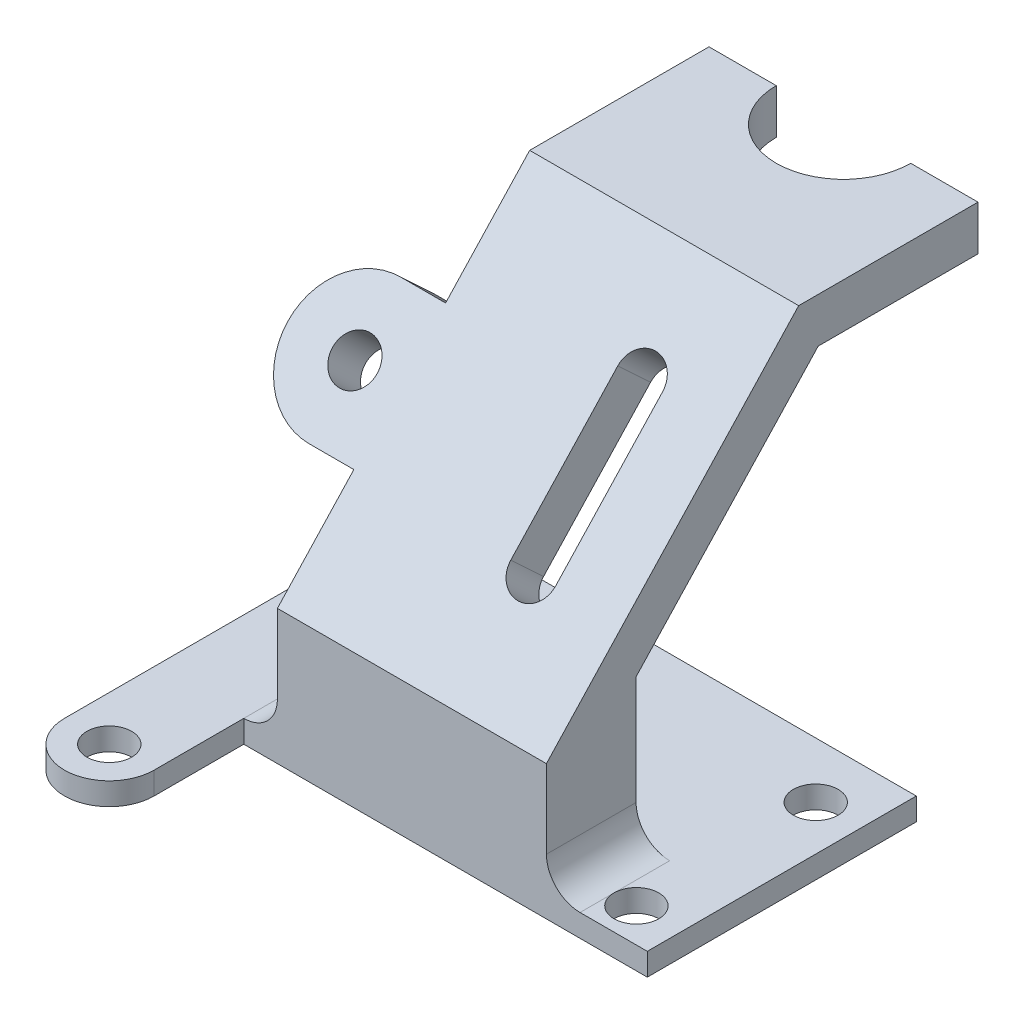
from build123d import *

# Parameters (mm, degrees)
BOSS_EXTRUDE1_DEPTH = 24
BOSS_EXTRUDE2_DEPTH = 8
SKETCH2_R           = 2
BOSS_EXTRUDE3_DEPTH = 2
SKETCH3_R           = 2
CUT_EXTRUDE1_DEPTH  = 37.612003683
BOSS_EXTRUDE4_DEPTH = 24
SKETCH6_R           = 2
BOSS_EXTRUDE5_DEPTH = 4
CUT_EXTRUDE2_DEPTH  = 4
CUT_EXTRUDE4_DEPTH  = 59.761051842


with BuildPart() as part:
    # Sketch1 → Boss-Extrude1 (new body)
    with BuildSketch(Plane.XY):
        Polygon((-18.223289316, 0), (-16.691476591, 0), (25.776710684, 0), (25.776710684, 2), (19.776710684, 2), (16.776710684, 2), (-7.223289316, 2), (-10.223289316, 2), (-18.223289316, 2), align=None)
    extrude(amount=-BOSS_EXTRUDE1_DEPTH)

    # Sketch1<4> → Boss-Extrude2 (add)
    with BuildSketch(Plane.XY):
        with BuildLine():
            Line((16.776710684, 2), (19.776710684, 2))
            ThreePointArc((19.776710684, 2), (17.655390341, 2.878679656), (16.776710684, 5))
            Line((16.776710684, 5), (16.776710684, 12))
            Line((16.776710684, 12), (-7.223289316, 12))
            Line((-7.223289316, 12), (-7.223289316, 5))
            ThreePointArc((-7.223289316, 5), (-8.101968972, 2.878679656), (-10.223289316, 2))
            Line((-10.223289316, 2), (-7.223289316, 2))
            Line((-7.223289316, 2), (16.776710684, 2))
        make_face()
    extrude(amount=-BOSS_EXTRUDE2_DEPTH)

    # Sketch2 → Boss-Extrude3 (add)
    with BuildSketch(Plane(origin=(0, 2, 0), x_dir=(1, 0, 0), z_dir=(0, 1, 0))):
        with BuildLine():
            Line((-18.223289316, 0), (-10.223289316, 0))
            Line((-10.223289316, 0), (-10.223289316, -8))
            ThreePointArc((-10.223289316, -8), (-14.223289316, -12), (-18.223289316, -8))
            Line((-18.223289316, -8), (-18.223289316, 0))
        make_face()
        with Locations((-14.223289316, -8)):
            Circle(SKETCH2_R, mode=Mode.SUBTRACT)
    extrude(amount=-BOSS_EXTRUDE3_DEPTH)

    # Sketch3 → Cut-Extrude1 (cut, through all)
    with BuildSketch(Plane(origin=(0, 2, 0), x_dir=(1, 0, 0), z_dir=(0, 1, 0))):
        with Locations((21.776710684, 3.027714233)):
            Circle(SKETCH3_R)
        with Locations((21.776710684, 19.027714233)):
            Circle(SKETCH3_R)
        with Locations((-14.223289316, 19.027714233)):
            Circle(SKETCH3_R)
    extrude(amount=-CUT_EXTRUDE1_DEPTH, mode=Mode.SUBTRACT)

    # Sketch5 → Boss-Extrude4 (add)
    with BuildSketch(Plane(origin=(16.776710684, 0, 0), x_dir=(0, 0, -1), z_dir=(1, 0, 0))):
        Polygon((8, 12), (0, 12), (22.505945882, 36.134672153), (38.505945882, 36.134672153), (38.505945882, 32.134672153), (24.245195382, 32.134672153), (19.201196493, 26.725645572), (8, 14.713832938), align=None)
    extrude(amount=-BOSS_EXTRUDE4_DEPTH)

    # Sketch6 → Boss-Extrude5 (add)
    # profile 1 of 2: a face of its own
    with BuildSketch(Plane(origin=(0, 5.581461158, 5.985384302), x_dir=(1, 0, 0), z_dir=(0, 0.6819983600624966, 0.7313537016191722))):
        with BuildLine():
            Line((-7.223289316, 18.776244419), (-11.223289316, 18.776244419))
            ThreePointArc((-11.223289316, 18.776244419), (-17.223289316, 24.776244419), (-11.223289316, 30.776244419))
            Line((-11.223289316, 30.776244419), (-7.223289316, 30.776244419))
            Line((-7.223289316, 30.776244419), (-7.223289316, 18.776244419))
        make_face()
        with Locations((-11.223289316, 24.776244419)):
            Circle(SKETCH6_R, mode=Mode.SUBTRACT)
    # profile 2 of 2: a face of its own
    with BuildSketch(Plane(origin=(0, 5.581461158, 5.985384302), x_dir=(1, 0, 0), z_dir=(0, 0.6819983600624966, 0.7313537016191722))):
        with BuildLine():
            Line((10.776710684, 32.776244419), (10.776710684, 18.776244419))
            ThreePointArc((10.776710684, 18.776244419), (8.776710684, 16.776244419), (6.776710684, 18.776244419))
            Line((6.776710684, 18.776244419), (6.776710684, 32.776244419))
            ThreePointArc((6.776710684, 32.776244419), (8.776710684, 34.776244419), (10.776710684, 32.776244419))
        make_face()
    extrude(amount=-BOSS_EXTRUDE5_DEPTH)

    # Sketch6<5> → Cut-Extrude2 (cut)
    with BuildSketch(Plane(origin=(0, 5.581461158, 5.985384302), x_dir=(1, 0, 0), z_dir=(0, 0.6819983600624966, 0.7313537016191722))):
        with BuildLine():
            Line((10.776710684, 18.776244419), (10.776710684, 32.776244419))
            ThreePointArc((10.776710684, 32.776244419), (8.776710684, 34.776244419), (6.776710684, 32.776244419))
            Line((6.776710684, 32.776244419), (6.776710684, 18.776244419))
            ThreePointArc((6.776710684, 18.776244419), (8.776710684, 16.776244419), (10.776710684, 18.776244419))
        make_face()
    extrude(amount=-CUT_EXTRUDE2_DEPTH, mode=Mode.SUBTRACT)

    # Sketch7 → Cut-Extrude4 (cut, through all)
    with BuildSketch(Plane(origin=(0, 36.134672153, 0), x_dir=(1, 0, 0), z_dir=(0, 1, 0))):
        with BuildLine():
            Line((-1.223289316, 38.505945882), (10.776710684, 38.505945882))
            ThreePointArc((10.776710684, 38.505945882), (4.776710684, 32.505945882), (-1.223289316, 38.505945882))
        make_face()
    extrude(amount=-CUT_EXTRUDE4_DEPTH, mode=Mode.SUBTRACT)


solid = part.part
